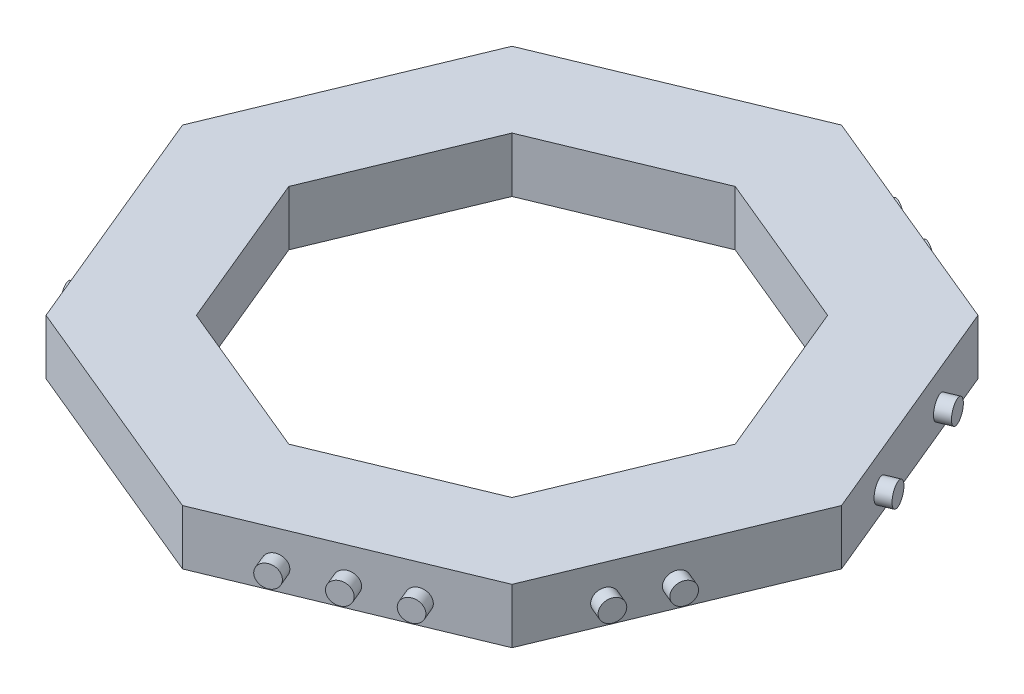
from build123d import *

# Parameters (mm, degrees)
BOSS_EXTRUDE1_DEPTH  = 5
CUT_EXTRUDE1_DEPTH   = 5
SKETCH6_R            = 1
BOSS_EXTRUDE5_DEPTH  = 1.25
SKETCH7_R            = 1
BOSS_EXTRUDE6_DEPTH  = 1.25
SKETCH8_R            = 1
BOSS_EXTRUDE7_DEPTH  = 1.25
BOSS_EXTRUDE8_START  = 1.25
SKETCH9_R            = 1
BOSS_EXTRUDE8_DEPTH  = 1.25
SKETCH10_R           = 1
BOSS_EXTRUDE9_DEPTH  = 1.25
BOSS_EXTRUDE10_START = 1.25
SKETCH11_R           = 1
BOSS_EXTRUDE10_DEPTH = 1.25
BOSS_EXTRUDE11_START = 1.25
SKETCH12_R           = 1
BOSS_EXTRUDE11_DEPTH = 1.25


with BuildPart() as part:
    # Sketch3 → Boss-Extrude1 (new body)
    with BuildSketch(Plane(origin=(0, 0, 0), x_dir=(1, 0, 0), z_dir=(0, 1, 0))):
        Polygon((30, 0), (21.213203436, 21.213203436), (0, 30), (-21.213203436, 21.213203436), (-30, 0), (-21.213203436, -21.213203436), (0, -30), (21.213203436, -21.213203436), align=None)
    extrude(amount=BOSS_EXTRUDE1_DEPTH)

    # Sketch5 → Cut-Extrude1 (cut)
    with BuildSketch(Plane(origin=(0, 5, 0), x_dir=(1, 0, 0), z_dir=(0, 1, 0))):
        Polygon((20.32, 0), (14.368409794, 14.368409794), (0, 20.32), (-14.368409794, 14.368409794), (-20.32, 0), (-14.368409794, -14.368409794), (0, -20.32), (14.368409794, -14.368409794), align=None)
    extrude(amount=-CUT_EXTRUDE1_DEPTH, mode=Mode.SUBTRACT)

    # Sketch6 → Boss-Extrude5 (add)
    with BuildSketch(Plane(origin=(10.606601718, 0, 25.606601718), x_dir=(0.9238795325112827, 0, -0.38268343236509966), z_dir=(0.38268343236509966, 0, 0.9238795325112827))):
        with Locations(Location((0, 2, 0), (0, 0, 180))):
            Circle(SKETCH6_R)
        with Locations(Location((-5, 2, 0), (0, 0, 180))):
            Circle(SKETCH6_R)
        with Locations(Location((5, 2, 0), (0, 0, 180))):
            Circle(SKETCH6_R)
    extrude(amount=BOSS_EXTRUDE5_DEPTH)

    # Sketch7 → Boss-Extrude6 (add)
    with BuildSketch(Plane(origin=(-25.606601718, 0, 10.606601718), x_dir=(0.3826834323650997, 0, 0.9238795325112827), z_dir=(-0.9238795325112827, 0, 0.3826834323650997))):
        with Locations(Location((5, 2, 0), (0, 0, 180))):
            Circle(SKETCH7_R)
    extrude(amount=BOSS_EXTRUDE6_DEPTH)

    # Sketch8 → Boss-Extrude7 (add)
    with BuildSketch(Plane(origin=(-25.606601718, 0, -10.606601718), x_dir=(-0.3826834323650795, 0, 0.9238795325112911), z_dir=(-0.9238795325112911, 0, -0.3826834323650795))):
        with Locations(Location((0, 2, 0), (0, 0, 180))):
            Circle(SKETCH8_R)
    extrude(amount=BOSS_EXTRUDE7_DEPTH)

    # Sketch9 → Boss-Extrude8 (add)
    with BuildSketch(Plane(origin=(-10.606601718, 0, -25.606601718), x_dir=(-0.9238795325112826, 0, 0.38268343236509983), z_dir=(-0.38268343236509983, 0, -0.9238795325112826)).offset(BOSS_EXTRUDE8_START)):
        with Locations((-5, 2)):
            Circle(SKETCH9_R)
    extrude(amount=-BOSS_EXTRUDE8_DEPTH)

    # Sketch10 → Boss-Extrude9 (add)
    with BuildSketch(Plane(origin=(10.606601718, 0, -25.606601718), x_dir=(-0.923879532511291, 0, -0.38268343236507973), z_dir=(0.38268343236507973, 0, -0.923879532511291))):
        with Locations(Location((0, 2, 0), (0, 0, 180))):
            Circle(SKETCH10_R)
        with Locations(Location((5, 2, 0), (0, 0, 180))):
            Circle(SKETCH10_R)
    extrude(amount=BOSS_EXTRUDE9_DEPTH)

    # Sketch11 → Boss-Extrude10 (add)
    with BuildSketch(Plane(origin=(25.606601718, 0, -10.606601718), x_dir=(-0.3826834323651001, 0, -0.9238795325112825), z_dir=(0.9238795325112824, 0, -0.38268343236510005)).offset(BOSS_EXTRUDE10_START)):
        with Locations(Location((5, 2, 0), (0, 0, 180))):
            Circle(SKETCH11_R)
        with Locations((-5, 2)):
            Circle(SKETCH11_R)
    extrude(amount=-BOSS_EXTRUDE10_DEPTH)

    # Sketch12 → Boss-Extrude11 (add)
    with BuildSketch(Plane(origin=(25.606601718, 0, 10.606601718), x_dir=(0.3826834323650795, 0, -0.923879532511291), z_dir=(0.9238795325112911, 0, 0.38268343236507957)).offset(BOSS_EXTRUDE11_START)):
        with Locations((0, 2)):
            Circle(SKETCH12_R)
        with Locations(Location((-5, 2, 0), (0, 0, 180))):
            Circle(SKETCH12_R)
    extrude(amount=-BOSS_EXTRUDE11_DEPTH)


solid = part.part
